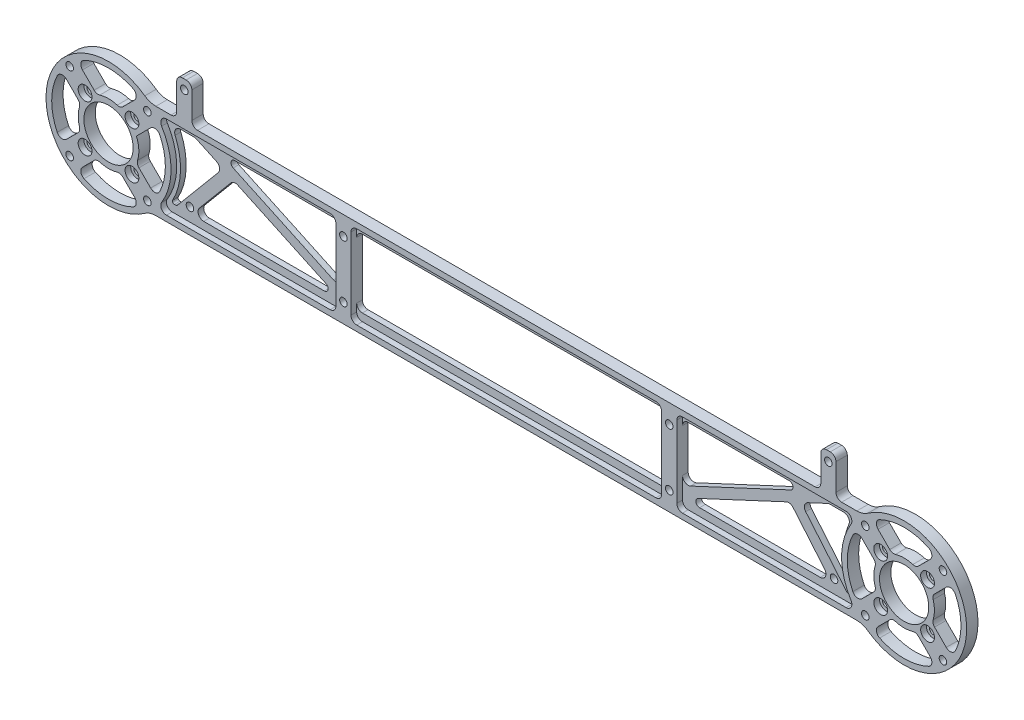
from build123d import *

# Parameters (mm, degrees)
SKETCH_1_R          = 2
SKETCH_1_R_2        = 13
SKETCH_1_W          = 164
SKETCH_1_H          = 36
EXTRUDE_1_DEPTH     = 6
SKETCH_2_R          = 2
CUT_EXTRUDE_1_DEPTH = 455.240024657
SKETCH_3_W          = 8
SKETCH_3_H          = 20
SKETCH_3_R          = 2
EXTRUDE_2_DEPTH     = 6
FILLET_2_R          = 3
SKETCH_4_R          = 2
CUT_EXTRUDE_2_DEPTH = 456.269151162
FILLET_3_R          = 3
FILLET_4_R          = 2
CUT_EXTRUDE_START   = -3
SKETCH_9_W          = 164
SKETCH_9_H          = 44
CUT_EXTRUDE_3_DEPTH = 3
FILLET_5_R          = 3
CUT_EXTRUDE_4_DEPTH = 456.269151162
FILLET_6_R          = 3
SKETCH_12_R         = 3.65
CUT_EXTRUDE_5_DEPTH = 3
FILLET_7_R          = 10
FILLET_8_R          = 1


with BuildPart() as part:
    # 草图1 → 凸台-拉伸1 (new body)
    with BuildSketch(Plane.XY):
        with BuildLine():
            Line((21.540659229, 25), (398.459340771, 25))
            ThreePointArc((398.459340771, 25), (453, 0), (398.459340771, -25))
            Line((398.459340771, -25), (21.540659229, -25))
            ThreePointArc((21.540659229, -25), (-33, 0), (21.540659229, 25))
        make_face()
        with Locations((-20.506096654, 20.506096654)):
            Circle(SKETCH_1_R, mode=Mode.SUBTRACT)
        with Locations((20.506096654, 20.506096654)):
            Circle(SKETCH_1_R, mode=Mode.SUBTRACT)
        with Locations((20.506096654, -20.506096654)):
            Circle(SKETCH_1_R, mode=Mode.SUBTRACT)
        with Locations((-20.506096654, -20.506096654)):
            Circle(SKETCH_1_R, mode=Mode.SUBTRACT)
        Circle(SKETCH_1_R_2, mode=Mode.SUBTRACT)
        with Locations((440.506096654, 20.506096654)):
            Circle(SKETCH_1_R, mode=Mode.SUBTRACT)
        with Locations((420, 0)):
            Circle(SKETCH_1_R_2, mode=Mode.SUBTRACT)
        with Locations((440.506096654, -20.506096654)):
            Circle(SKETCH_1_R, mode=Mode.SUBTRACT)
        with Locations((399.493903346, -20.506096654)):
            Circle(SKETCH_1_R, mode=Mode.SUBTRACT)
        with Locations((399.493903346, 20.506096654)):
            Circle(SKETCH_1_R, mode=Mode.SUBTRACT)
        with Locations((-12.374368671, 12.374368671)):
            Circle(SKETCH_1_R, mode=Mode.SUBTRACT)
        with Locations((12.374368671, 12.374368671)):
            Circle(SKETCH_1_R, mode=Mode.SUBTRACT)
        with Locations((12.374368671, -12.374368671)):
            Circle(SKETCH_1_R, mode=Mode.SUBTRACT)
        with Locations((-12.374368671, -12.374368671)):
            Circle(SKETCH_1_R, mode=Mode.SUBTRACT)
        with Locations((432.374368671, 12.374368671)):
            Circle(SKETCH_1_R, mode=Mode.SUBTRACT)
        with Locations((432.374368671, -12.374368671)):
            Circle(SKETCH_1_R, mode=Mode.SUBTRACT)
        with Locations((407.625631329, -12.374368671)):
            Circle(SKETCH_1_R, mode=Mode.SUBTRACT)
        with Locations((407.625631329, 12.374368671)):
            Circle(SKETCH_1_R, mode=Mode.SUBTRACT)
        with BuildLine():
            Line((30.01666204, 18), (120, 18))
            Line((120, 18), (120, -18))
            Line((120, -18), (30.01666204, -18))
            ThreePointArc((30.01666204, -18), (35, 0), (30.01666204, 18))
        make_face(mode=Mode.SUBTRACT)
        with BuildLine():
            Line((300, 18), (389.98333796, 18))
            ThreePointArc((389.98333796, 18), (385, 0), (389.98333796, -18))
            Line((389.98333796, -18), (300, -18))
            Line((300, -18), (300, 18))
        make_face(mode=Mode.SUBTRACT)
        with Locations((210, 0)):
            Rectangle(SKETCH_1_W, SKETCH_1_H, mode=Mode.SUBTRACT)
    extrude(amount=EXTRUDE_1_DEPTH)

    # 草图2 → 切除-拉伸1 (cut, through all)
    with BuildSketch(Plane.XY.offset(6)):
        with Locations((124, 15)):
            Circle(SKETCH_2_R)
        with Locations((124, -15)):
            Circle(SKETCH_2_R)
        with Locations((296, 15)):
            Circle(SKETCH_2_R)
        with Locations((296, -15)):
            Circle(SKETCH_2_R)
    extrude(amount=-CUT_EXTRUDE_1_DEPTH, mode=Mode.SUBTRACT)

    # 草图3 → 凸台-拉伸2 (add)
    # profile 1 of 4: a face of its own
    with BuildSketch(Plane.XY.offset(6)):
        with Locations((40, 35)):
            Rectangle(SKETCH_3_W, SKETCH_3_H)
        with Locations((40, 40)):
            Circle(SKETCH_3_R, mode=Mode.SUBTRACT)
    # profile 2 of 4: a face of its own
    with BuildSketch(Plane.XY.offset(6)):
        with Locations((380, 35)):
            Rectangle(SKETCH_3_W, SKETCH_3_H)
        with Locations((380, 40)):
            Circle(SKETCH_3_R, mode=Mode.SUBTRACT)
    # profile 3 of 4: a face of its own
    with BuildSketch(Plane.XY.offset(6)):
        Polygon((120, -12.483110405), (54.628758777, 18), (42.797750862, 18), (57.467592039, 11.159340715), (33, -18), (40.832443736, -18), (63.097265224, 8.534180996), (120, -18), align=None)
    # profile 4 of 4: a face of its own
    with BuildSketch(Plane.XY.offset(6)):
        Polygon((387, -18), (379.167556264, -18), (356.902734776, 8.534180996), (300, -18), (300, -12.483110405), (365.371241223, 18), (377.202249138, 18), (362.532407961, 11.159340715), align=None)
    extrude(amount=-EXTRUDE_2_DEPTH)

    # 圆角2
    fillet_2_edges = [part.edges().sort_by_distance(p)[0] for p in [
        (44, 25, 3),
        (44, 45, 3),
        (36, 45, 3),
        (36, 25, 3),
        (376, 45, 3),
        (376, 25, 3),
        (384, 25, 3),
        (384, 45, 3),
    ]]
    fillet(fillet_2_edges, radius=FILLET_2_R)

    # 草图4 → 切除-拉伸2 (cut, through all)
    with BuildSketch(Plane.XY.offset(6)):
        with Locations((40, -15)):
            Circle(SKETCH_4_R)
        with Locations((380, -15)):
            Circle(SKETCH_4_R)
    extrude(amount=-CUT_EXTRUDE_2_DEPTH, mode=Mode.SUBTRACT)

    # 圆角3
    fillet_3_edges = [part.edges().sort_by_distance(p)[0] for p in [
        (120, -12.483110405, 3),
        (63.097265224, 8.534180996, 3),
        (40.832443736, -18, 3),
        (57.467592039, 11.159340715, 3),
        (42.797750862, 18, 3),
        (362.532407961, 11.159340715, 3),
        (379.167556264, -18, 3),
        (356.902734776, 8.534180996, 3),
        (300, -12.483110405, 3),
        (377.202249138, 18, 3),
        (120, 18, 3),
        (30.01666204, 18, 3),
        (389.98333796, 18, 3),
        (300, 18, 3),
        (292, -18, 3),
        (292, 18, 3),
        (128, 18, 3),
        (128, -18, 3),
    ]]
    fillet(fillet_3_edges, radius=FILLET_3_R)

    # 圆角4
    fillet_4_edges = [part.edges().sort_by_distance(p)[0] for p in [
        (54.628758777, 18, 3),
        (365.371241223, 18, 3),
        (120, -18, 3),
        (300, -18, 3),
    ]]
    fillet(fillet_4_edges, radius=FILLET_4_R)

    # 草图9 → 切除-拉伸3 (cut)
    with BuildSketch(Plane.XY.offset(6).offset(CUT_EXTRUDE_START)):
        with BuildLine():
            Line((395.403252248, 22), (300, 22))
            Line((300, 22), (300, -22))
            Line((300, -22), (395.403252248, -22))
            ThreePointArc((395.403252248, -22), (387, 0), (395.403252248, 22))
        make_face()
        with BuildLine():
            Line((24.596747752, -22), (120, -22))
            Line((120, -22), (120, 22))
            Line((120, 22), (24.596747752, 22))
            ThreePointArc((24.596747752, 22), (33, 0), (24.596747752, -22))
        make_face()
        with Locations((210, 0)):
            Rectangle(SKETCH_9_W, SKETCH_9_H)
    extrude(amount=CUT_EXTRUDE_3_DEPTH, mode=Mode.SUBTRACT)

    # 圆角5
    fillet_5_edges = [part.edges().sort_by_distance(p)[0] for p in [
        (120, 22, 4.5),
        (24.596747752, -22, 4.5),
        (24.596747752, 22, 4.5),
        (120, -22, 4.5),
        (300, -22, 4.5),
        (395.403252248, -22, 4.5),
        (300, 22, 4.5),
        (395.403252248, 22, 4.5),
        (292, 22, 4.5),
        (128, -22, 4.5),
        (128, 22, 4.5),
        (292, -22, 4.5),
    ]]
    fillet(fillet_5_edges, radius=FILLET_5_R)

    # 草图10 → 切除-拉伸4 (cut, through all)
    with BuildSketch(Plane.XY.offset(6)):
        with BuildLine():
            Line((-16.541969004, 25.027250378), (-6.245447795, 14.730729169))
            ThreePointArc((-6.245447795, 14.730729169), (0, 16), (6.245447795, 14.730729169))
            Line((6.245447795, 14.730729169), (16.541969004, 25.027250378))
            ThreePointArc((16.541969004, 25.027250378), (0, 30), (-16.541969004, 25.027250378))
        make_face()
        with BuildLine():
            Line((25.027250378, -16.541969004), (14.730729169, -6.245447795))
            ThreePointArc((14.730729169, -6.245447795), (16, 0), (14.730729169, 6.245447795))
            Line((14.730729169, 6.245447795), (25.027250378, 16.541969004))
            ThreePointArc((25.027250378, 16.541969004), (30, 0), (25.027250378, -16.541969004))
        make_face()
        with BuildLine():
            Line((-16.541969004, -25.027250378), (-6.245447795, -14.730729169))
            ThreePointArc((-6.245447795, -14.730729169), (0, -16), (6.245447795, -14.730729169))
            Line((6.245447795, -14.730729169), (16.541969004, -25.027250378))
            ThreePointArc((16.541969004, -25.027250378), (0, -30), (-16.541969004, -25.027250378))
        make_face()
        with BuildLine():
            Line((-25.027250378, 16.541969004), (-14.730729169, 6.245447795))
            ThreePointArc((-14.730729169, 6.245447795), (-16, 0), (-14.730729169, -6.245447795))
            Line((-14.730729169, -6.245447795), (-25.027250378, -16.541969004))
            ThreePointArc((-25.027250378, -16.541969004), (-30, 0), (-25.027250378, 16.541969004))
        make_face()
        with BuildLine():
            Line((445.027250378, -16.541969004), (434.730729169, -6.245447795))
            ThreePointArc((434.730729169, -6.245447795), (436, 0), (434.730729169, 6.245447795))
            Line((434.730729169, 6.245447795), (445.027250378, 16.541969004))
            ThreePointArc((445.027250378, 16.541969004), (450, 0), (445.027250378, -16.541969004))
        make_face()
        with BuildLine():
            Line((436.541969004, 25.027250378), (426.245447795, 14.730729169))
            ThreePointArc((426.245447795, 14.730729169), (420, 16), (413.754552205, 14.730729169))
            Line((413.754552205, 14.730729169), (403.458030996, 25.027250378))
            ThreePointArc((403.458030996, 25.027250378), (420, 30), (436.541969004, 25.027250378))
        make_face()
        with BuildLine():
            Line((403.458030996, -25.027250378), (413.754552205, -14.730729169))
            ThreePointArc((413.754552205, -14.730729169), (420, -16), (426.245447795, -14.730729169))
            Line((426.245447795, -14.730729169), (436.541969004, -25.027250378))
            ThreePointArc((436.541969004, -25.027250378), (420, -30), (403.458030996, -25.027250378))
        make_face()
        with BuildLine():
            Line((394.972749622, 16.541969004), (405.269270831, 6.245447795))
            ThreePointArc((405.269270831, 6.245447795), (404, 0), (405.269270831, -6.245447795))
            Line((405.269270831, -6.245447795), (394.972749622, -16.541969004))
            ThreePointArc((394.972749622, -16.541969004), (390, 0), (394.972749622, 16.541969004))
        make_face()
    extrude(amount=-CUT_EXTRUDE_4_DEPTH, mode=Mode.SUBTRACT)

    # 圆角6
    fillet_6_edges = [part.edges().sort_by_distance(p)[0] for p in [
        (16.541969004, -25.027250378, 3),
        (-16.541969004, -25.027250378, 3),
        (-6.245447795, -14.730729169, 3),
        (6.245447795, -14.730729169, 3),
        (-25.027250378, -16.541969004, 3),
        (-25.027250378, 16.541969004, 3),
        (-14.730729169, 6.245447795, 3),
        (-14.730729169, -6.245447795, 3),
        (25.027250378, 16.541969004, 3),
        (25.027250378, -16.541969004, 3),
        (14.730729169, -6.245447795, 3),
        (403.458030996, 25.027250378, 3),
        (436.541969004, 25.027250378, 3),
        (426.245447795, 14.730729169, 3),
        (413.754552205, 14.730729169, 3),
        (394.972749622, -16.541969004, 3),
        (394.972749622, 16.541969004, 3),
        (405.269270831, 6.245447795, 3),
        (405.269270831, -6.245447795, 3),
        (445.027250378, 16.541969004, 3),
        (445.027250378, -16.541969004, 3),
        (434.730729169, -6.245447795, 3),
        (434.730729169, 6.245447795, 3),
        (436.541969004, -25.027250378, 3),
        (403.458030996, -25.027250378, 3),
        (413.754552205, -14.730729169, 3),
        (426.245447795, -14.730729169, 3),
        (-16.541969004, 25.027250378, 3),
        (16.541969004, 25.027250378, 3),
        (6.245447795, 14.730729169, 3),
        (-6.245447795, 14.730729169, 3),
    ]]
    fillet(fillet_6_edges, radius=FILLET_6_R)

    # 草图12 → 切除-拉伸5 (cut)
    with BuildSketch(Plane.XY.offset(6)):
        with Locations((-12.374368671, 12.374368671)):
            Circle(SKETCH_12_R)
        with Locations((12.374368671, 12.374368671)):
            Circle(SKETCH_12_R)
        with Locations((-12.374368671, -12.374368671)):
            Circle(SKETCH_12_R)
        with Locations((12.374368671, -12.374368671)):
            Circle(SKETCH_12_R)
        with Locations((407.625631329, 12.374368671)):
            Circle(SKETCH_12_R)
        with Locations((432.374368671, 12.374368671)):
            Circle(SKETCH_12_R)
        with Locations((432.374368671, -12.374368671)):
            Circle(SKETCH_12_R)
        with Locations((407.625631329, -12.374368671)):
            Circle(SKETCH_12_R)
    extrude(amount=-CUT_EXTRUDE_5_DEPTH, mode=Mode.SUBTRACT)

    # 圆角7
    fillet_7_edges = [part.edges().sort_by_distance(p)[0] for p in [
        (21.540659229, 25, 3),
        (398.459340771, 25, 3),
        (398.459340771, -25, 3),
        (21.540659229, -25, 3),
    ]]
    fillet(fillet_7_edges, radius=FILLET_7_R)

    # 圆角8
    fillet_8_edges = [part.edges().sort_by_distance(p)[0] for p in [
        (33, -18, 1.5),
        (387, -18, 1.5),
        (389.98333796, -18, 1.5),
        (30.01666204, -18, 1.5),
    ]]
    fillet(fillet_8_edges, radius=FILLET_8_R)


solid = part.part
